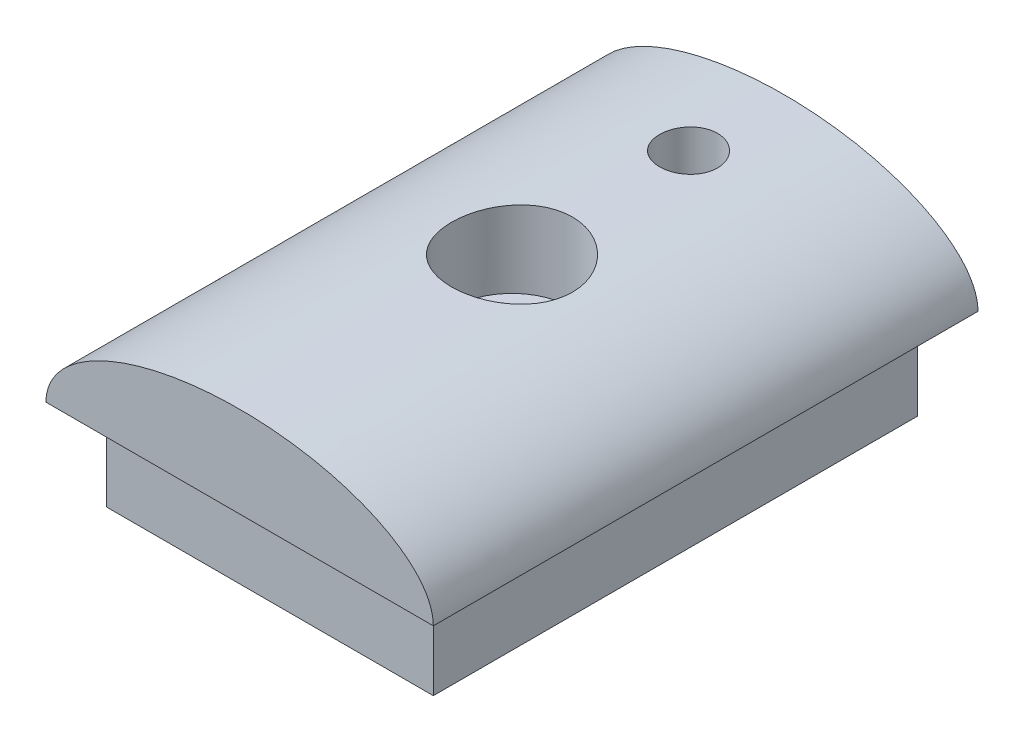
from build123d import *

# Parameters (mm, degrees)
EXTRUDE_1_DEPTH     = 90
SKETCH_2_W          = 54
SKETCH_2_H          = 80
SKETCH_2_W_2        = 48
SKETCH_2_H_2        = 74
EXTRUDE_2_DEPTH     = 15
SKETCH_3_W          = 48
SKETCH_3_H          = 3
CUT_EXTRUDE_1_DEPTH = 5
SKETCH_5_RX         = 24
SKETCH_5_RY         = 8
CUT_EXTRUDE_3_DEPTH = 74
EXTRUDE_9_REACH     = 98.69
SKETCH_15_R         = 11
SKETCH_16_R         = 10
CUT_EXTRUDE_4_DEPTH = 98.020616492
SKETCH_17_W         = 5
SKETCH_17_H         = 10
CUT_EXTRUDE_6_DEPTH = 98.020616492
SCALE_1_SCALE       = 1.2
SKETCH_18_R         = 5.75
CUT_EXTRUDE_7_DEPTH = 117.028272558


with BuildPart() as part:
    # 草图1 → 凸台-拉伸1 (new body)
    with BuildSketch(Plane.XY):
        with BuildLine():
            Line((-32, 0), (32, 0))
            add(Edge.make_bspline(
                [(32, 0), (32, 15), (0, 15), (-32, 15), (-32, 0)],
                knots=[0, 0, 0, 1.570796327, 1.570796327, 3.141592654, 3.141592654, 3.141592654], degree=2, weights=[1, 0.707106781, 1, 0.707106781, 1]))
        make_face()
    extrude(amount=EXTRUDE_1_DEPTH)

    # 草图2 → 凸台-拉伸2 (add)
    with BuildSketch(Plane.XZ):
        with Locations((0, 45)):
            Rectangle(SKETCH_2_W, SKETCH_2_H)
        with Locations((0, 45)):
            Rectangle(SKETCH_2_W_2, SKETCH_2_H_2, mode=Mode.SUBTRACT)
    extrude(amount=EXTRUDE_2_DEPTH)

    # 草图3 → 切除-拉伸1 (cut)
    with BuildSketch(Plane.XZ.offset(15)):
        with Locations((0, 6.5)):
            Rectangle(SKETCH_3_W, SKETCH_3_H)
    extrude(amount=-CUT_EXTRUDE_1_DEPTH, mode=Mode.SUBTRACT)

    # 草图5 → 切除-拉伸3 (cut)
    with BuildSketch(Plane(origin=(0, 0, 82), x_dir=(-1, 0, 0), z_dir=(0, 0, -1))):
        with Locations(Location((0, 0), (0, 0, 180))):
            Ellipse(SKETCH_5_RX, SKETCH_5_RY)
    extrude(amount=CUT_EXTRUDE_3_DEPTH, mode=Mode.SUBTRACT)

    # 草图15 → 凸台-拉伸9 (add, up to next)
    with BuildSketch(Plane(origin=(0, 0, 0), x_dir=(-1, 0, 0), z_dir=(0, -1, 0)), mode=Mode.PRIVATE) as extrude_9_sk1:
        with Locations(Location((0, -45, 0), (0, 0, 90))):
            Circle(SKETCH_15_R)
    extrude_9_tool1 = extrude(extrude_9_sk1.sketch, amount=-EXTRUDE_9_REACH, mode=Mode.PRIVATE) - part.part
    add(extrude_9_tool1.solids().sort_by_distance((0, 0, 45))[0])

    # 草图16 → 切除-拉伸4 (cut, through all)
    with BuildSketch(Plane(origin=(0, 2, 0), x_dir=(-1, 0, 0), z_dir=(0, -1, 0))):
        with Locations(Location((0, -45, 0), (0, 0, 90))):
            Circle(SKETCH_16_R)
    extrude(amount=-CUT_EXTRUDE_4_DEPTH, mode=Mode.SUBTRACT)

    # 草图17 → 切除-拉伸6 (cut, through all)
    with BuildSketch(Plane(origin=(0, 2, 0), x_dir=(1, 0, 0), z_dir=(0, 1, 0))):
        with Locations((-4, -45)):
            Rectangle(SKETCH_17_W, SKETCH_17_H)
    cut_extrude_6 = extrude(amount=-CUT_EXTRUDE_6_DEPTH, mode=Mode.SUBTRACT)

    # 镜向1: 切除-拉伸6 across plane
    add(cut_extrude_6.mirror(Plane(origin=(0, 0, 0), x_dir=(0, 0, 1), z_dir=(1, 0, 0))), mode=Mode.SUBTRACT)


with BuildPart() as part_1:
    # 缩放比例1: scaled about (0, 0, 0)
    add(part.part.scale(SCALE_1_SCALE))

    # 草图18 → 切除-拉伸7 (cut, through all)
    with BuildSketch(Plane.XZ):
        with Locations(Location((0, 19, 0), (0, 0, 270))):
            Circle(SKETCH_18_R)
    extrude(amount=-CUT_EXTRUDE_7_DEPTH, mode=Mode.SUBTRACT)


solid = part_1.part
